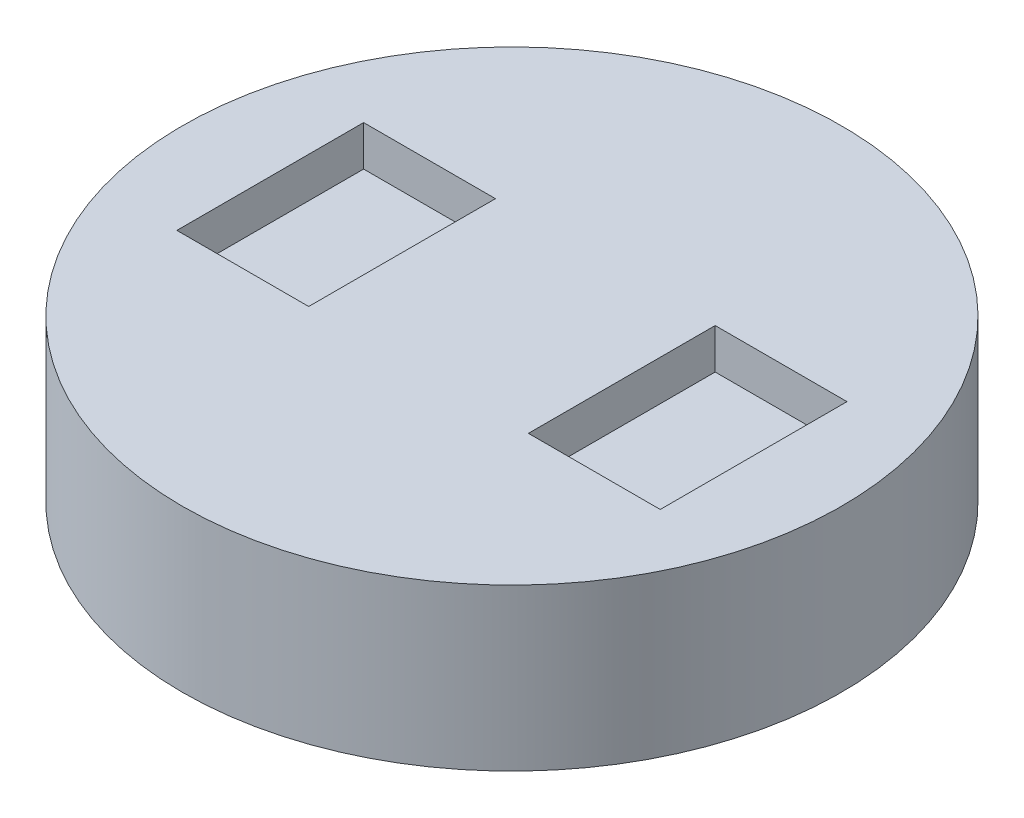
from build123d import *

# Parameters (mm, degrees)
SKETCH1_R           = 18
BOSS_EXTRUDE1_DEPTH = 8.8
SKETCH2_W           = 7.2
SKETCH2_H           = 10.2
CUT_EXTRUDE1_DEPTH  = 2.2


with BuildPart() as part:
    # Sketch1 → Boss-Extrude1 (new body)
    with BuildSketch(Plane(origin=(0, 0, 0), x_dir=(1, 0, 0), z_dir=(0, 1, 0))):
        with Locations(Location((0, 0, 0), (0, 0, 270))):
            Circle(SKETCH1_R)
    extrude(amount=BOSS_EXTRUDE1_DEPTH)

    # Sketch2 → Cut-Extrude1 (cut)
    with BuildSketch(Plane(origin=(0, 8.8, 0), x_dir=(1, 0, 0), z_dir=(0, 1, 0))):
        with Locations((-9.6, 0)):
            Rectangle(SKETCH2_W, SKETCH2_H)
        with Locations((9.6, 0)):
            Rectangle(SKETCH2_W, SKETCH2_H)
    extrude(amount=-CUT_EXTRUDE1_DEPTH, mode=Mode.SUBTRACT)


solid = part.part
